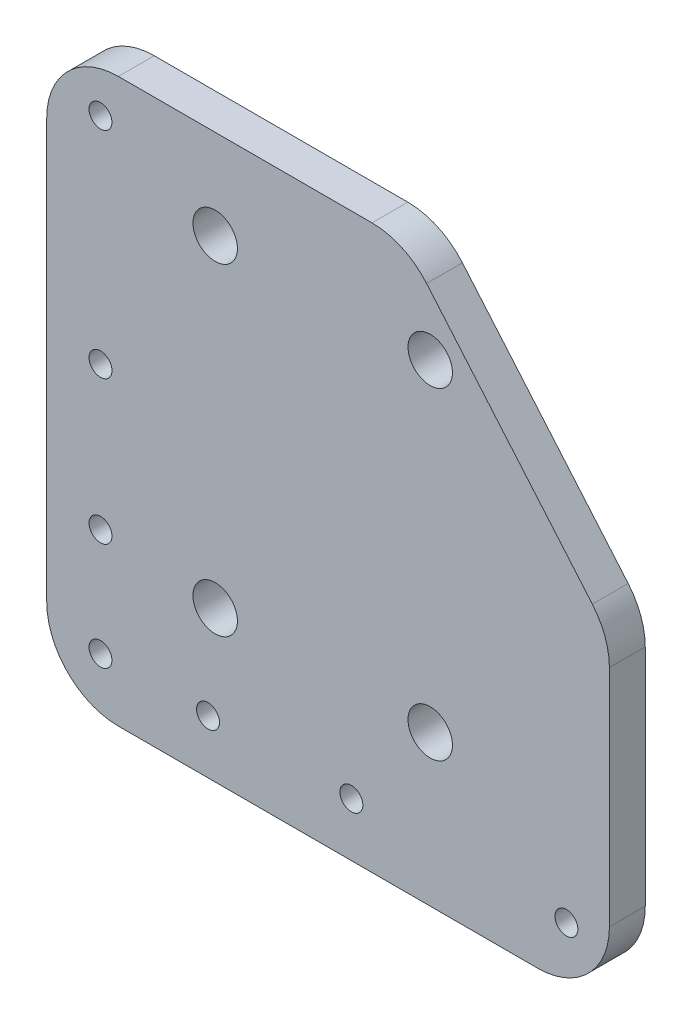
from build123d import *

# Parameters (mm, degrees)
SKETCH_1_R      = 1.6
SKETCH_1_R_2    = 3.1
EXTRUDE_1_DEPTH = 5
FILLET_1_R      = 10


with BuildPart() as part:
    # 草图1 → 凸台-拉伸1 (new body)
    with BuildSketch(Plane.XY):
        Polygon((-7.5, 71), (-7.5, -7.5), (71, -7.5), (71, 37.5), (42.5, 71), align=None)
        Circle(SKETCH_1_R, mode=Mode.SUBTRACT)
        with Locations((0, 15)):
            Circle(SKETCH_1_R, mode=Mode.SUBTRACT)
        with Locations((0, 35)):
            Circle(SKETCH_1_R, mode=Mode.SUBTRACT)
        with Locations((0, 65)):
            Circle(SKETCH_1_R, mode=Mode.SUBTRACT)
        with Locations((15, 0)):
            Circle(SKETCH_1_R, mode=Mode.SUBTRACT)
        with Locations((35, 0)):
            Circle(SKETCH_1_R, mode=Mode.SUBTRACT)
        with Locations((65, 0)):
            Circle(SKETCH_1_R, mode=Mode.SUBTRACT)
        with Locations((16, 58.5)):
            Circle(SKETCH_1_R_2, mode=Mode.SUBTRACT)
        with Locations((16, 13.5)):
            Circle(SKETCH_1_R_2, mode=Mode.SUBTRACT)
        with Locations((46, 13.5)):
            Circle(SKETCH_1_R_2, mode=Mode.SUBTRACT)
        with Locations((46, 58.5)):
            Circle(SKETCH_1_R_2, mode=Mode.SUBTRACT)
    extrude(amount=EXTRUDE_1_DEPTH)

    # 圆角1
    fillet_1_edges = [part.edges().sort_by_distance(p)[0] for p in [
        (42.5, 71, 2.5),
        (71, 37.5, 2.5),
        (71, -7.5, 2.5),
        (-7.5, -7.5, 2.5),
        (-7.5, 71, 2.5),
    ]]
    fillet(fillet_1_edges, radius=FILLET_1_R)


solid = part.part
